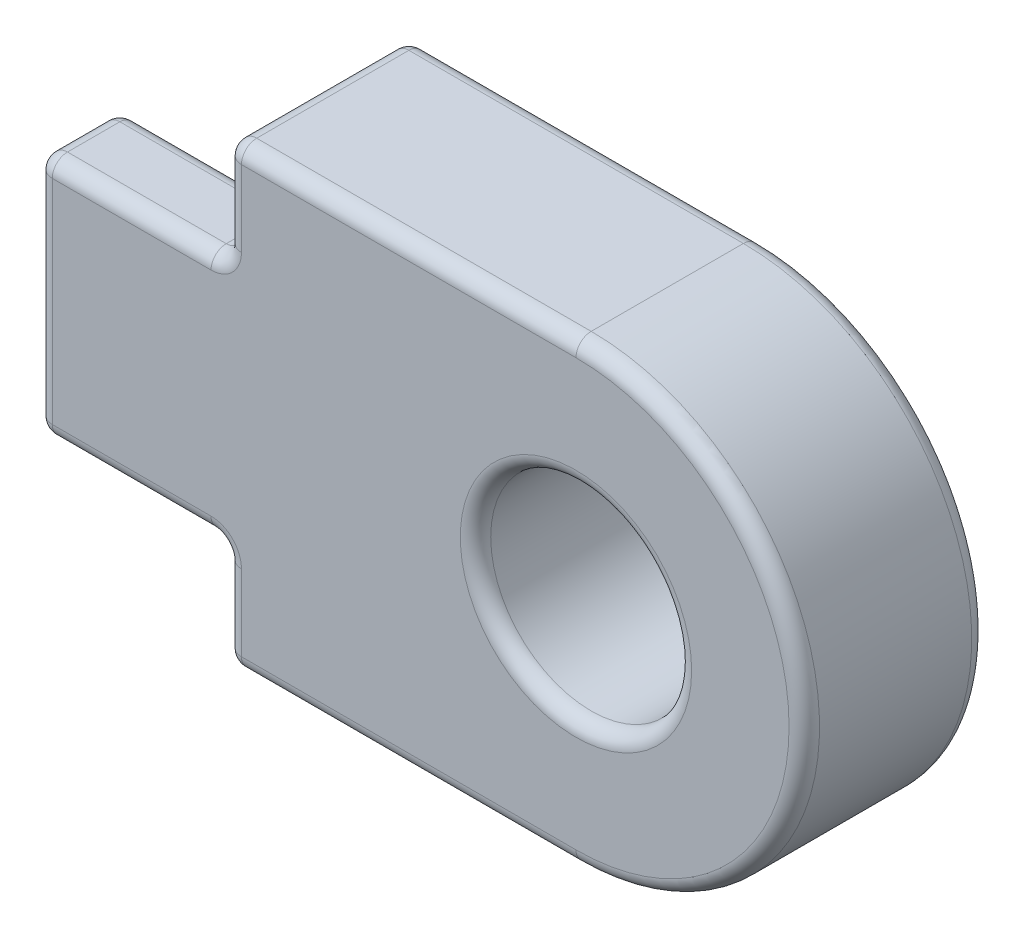
from build123d import *

# Parameters (mm, degrees)
SKETCH1_R                = 1.65
BOSS_EXTRUDE1_DEPTH      = 3
BOSS_EXTRUDE2_DEPTH      = 2
BOSS_EXTRUDE2_DEPTH_BACK = 2
SKETCH2_W                = 3.107139826
SKETCH2_H                = 1.36
FILLET1_R                = 0.25


with BuildPart() as part:
    # Sketch1 → Boss-Extrude1 (new body)
    with BuildSketch(Plane(origin=(0, 0, 0), x_dir=(0, 1, 0), z_dir=(0, 0, 1))):
        with BuildLine():
            Line((-3.75, 0), (-3.75, 5.743917642))
            Line((-3.75, 5.743917642), (3.75, 5.743917642))
            Line((3.75, 5.743917642), (3.75, 0))
            ThreePointArc((3.75, 0), (0, -3.75), (-3.75, 0))
        make_face()
        with Locations(Location((0, 0, 0), (0, 0, 270))):
            Circle(SKETCH1_R, mode=Mode.SUBTRACT)
    extrude(amount=BOSS_EXTRUDE1_DEPTH)

    # Sketch2 → Boss-Extrude2 (add, two sides: drawn at the far end of the back side and taken through both)
    with BuildSketch(Plane(origin=(0, 0, 0), x_dir=(-1, 0, 0), z_dir=(0, 1, 0)).offset(-BOSS_EXTRUDE2_DEPTH_BACK)):
        with Locations((7.297487555, 2.32)):
            Rectangle(SKETCH2_W, SKETCH2_H)
    extrude(amount=BOSS_EXTRUDE2_DEPTH + BOSS_EXTRUDE2_DEPTH_BACK)

    # Fillet1
    fillet1_edges = [part.edges().sort_by_distance(p)[0] for p in [
        (-1.65, 0, 0),
        (-1.65, 0, 3),
        (-5.743917642, 2.875, 3),
        (-2.871958821, -3.75, 3),
        (-5.743917642, -2.875, 3),
        (-5.743917642, -2, 2.32),
        (-5.743917642, 0, 1.64),
        (-7.297487555, -2, 1.64),
        (-8.851057468, 0, 1.64),
        (-8.851057468, -2, 2.32),
        (-8.851057468, 0, 3),
        (-7.297487555, -2, 3),
        (-5.743917642, 2, 2.32),
        (-7.297487555, 2, 1.64),
        (-8.851057468, 2, 2.32),
        (-7.297487555, 2, 3),
        (3.75, 0, 3),
        (-2.871958821, -3.75, 0),
        (-5.743917642, 0, 0),
        (-2.871958821, 3.75, 0),
        (3.75, 0, 0),
        (-5.743917642, -3.75, 1.5),
        (-5.743917642, 3.75, 1.5),
        (-2.871958821, 3.75, 3),
    ]]
    fillet(fillet1_edges, radius=FILLET1_R)


solid = part.part
